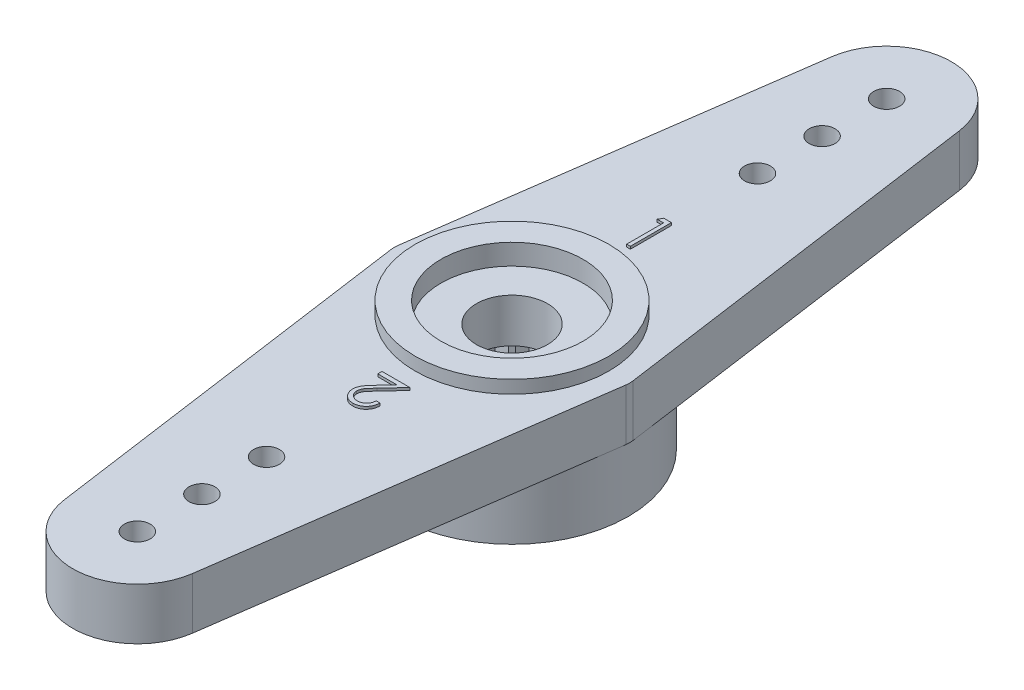
from build123d import *

# Parameters (mm, degrees)
SKETCH1_R           = 0.5
SKETCH1_R_2         = 1.375
BOSS_EXTRUDE1_DEPTH = 2
SKETCH2_R           = 3.75
SKETCH2_R_2         = 2.75
BOSS_EXTRUDE2_DEPTH = 0.5
CUT_EXTRUDE1_START  = -0.8
SKETCH3_R           = 2.75
SKETCH3_R_2         = 1.375
CUT_EXTRUDE1_DEPTH  = 0.8
SKETCH4_R           = 4.5
SKETCH4_R_2         = 2.5
BOSS_EXTRUDE3_DEPTH = 2.5
CUT_EXTRUDE3_START  = -2.5
CUT_EXTRUDE3_DEPTH  = 2.5
BOSS_EXTRUDE4_DEPTH = 0.1
FILLET1_R           = 1


with BuildPart() as part:
    # Sketch1 → Boss-Extrude1 (new body)
    with BuildSketch(Plane(origin=(0, 0, 0), x_dir=(1, 0, 0), z_dir=(0, 1, 0))):
        with BuildLine():
            Line((-4, 4), (-2.475677962, 14.847877319))
            ThreePointArc((-2.475677962, 14.847877319), (0, 17), (2.475677962, 14.847877319))
            Line((2.475677962, 14.847877319), (4, 4))
            Line((4, 4), (4.562072005, 0))
            Line((4.562072005, 0), (4, -4))
            Line((4, -4), (2.475677962, -14.847877319))
            ThreePointArc((2.475677962, -14.847877319), (0, -17), (-2.475677962, -14.847877319))
            Line((-2.475677962, -14.847877319), (-4, -4))
            Line((-4, -4), (-4.562072005, 0))
            Line((-4.562072005, 0), (-4, 4))
        make_face()
        with Locations(Location((0, -9.5, 0), (0, 0, 270))):
            Circle(SKETCH1_R, mode=Mode.SUBTRACT)
        with Locations(Location((0, -12, 0), (0, 0, 270))):
            Circle(SKETCH1_R, mode=Mode.SUBTRACT)
        with Locations(Location((0, 14.5, 0), (0, 0, 270))):
            Circle(SKETCH1_R, mode=Mode.SUBTRACT)
        with Locations(Location((0, 12, 0), (0, 0, 270))):
            Circle(SKETCH1_R, mode=Mode.SUBTRACT)
        with Locations(Location((0, 9.5, 0), (0, 0, 270))):
            Circle(SKETCH1_R, mode=Mode.SUBTRACT)
        with Locations(Location((0, -14.5, 0), (0, 0, 270))):
            Circle(SKETCH1_R, mode=Mode.SUBTRACT)
        with Locations(Location((0, 0, 0), (0, 0, 270))):
            Circle(SKETCH1_R_2, mode=Mode.SUBTRACT)
    extrude(amount=BOSS_EXTRUDE1_DEPTH)

    # Sketch2 → Boss-Extrude2 (add)
    with BuildSketch(Plane(origin=(0, 2, 0), x_dir=(1, 0, 0), z_dir=(0, 1, 0))):
        with Locations(Location((0, 0, 0), (0, 0, 270))):
            Circle(SKETCH2_R)
        with Locations(Location((0, 0, 0), (0, 0, 270))):
            Circle(SKETCH2_R_2, mode=Mode.SUBTRACT)
    extrude(amount=BOSS_EXTRUDE2_DEPTH)

    # Sketch3 → Cut-Extrude1 (cut)
    with BuildSketch(Plane(origin=(0, 2.5, 0), x_dir=(1, 0, 0), z_dir=(0, 1, 0)).offset(CUT_EXTRUDE1_START)):
        with Locations(Location((0, 0, 0), (0, 0, 270))):
            Circle(SKETCH3_R)
        with Locations(Location((0, 0, 0), (0, 0, 270))):
            Circle(SKETCH3_R_2, mode=Mode.SUBTRACT)
    extrude(amount=CUT_EXTRUDE1_DEPTH, mode=Mode.SUBTRACT)

    # Sketch4 → Boss-Extrude3 (add)
    with BuildSketch(Plane.XZ):
        with Locations(Location((0, 0, 0), (0, 0, 90))):
            Circle(SKETCH4_R)
        with Locations(Location((0, 0, 0), (0, 0, 270))):
            Circle(SKETCH4_R_2, mode=Mode.SUBTRACT)
    extrude(amount=BOSS_EXTRUDE3_DEPTH)

    # Sketch5 → Cut-Extrude3 (cut)
    with BuildSketch(Plane.XZ.offset(2.5).offset(CUT_EXTRUDE3_START)):
        with BuildLine():
            Line((0.299038106, 2.482050808), (0, 3))
            Line((0, 3), (-0.299038106, 2.482050808))
            ThreePointArc((-0.299038106, 2.482050808), (-0.391086163, 2.469220851), (-0.482593741, 2.452978451))
            Line((-0.482593741, 2.452978451), (-0.927050983, 2.853169549))
            Line((-0.927050983, 2.853169549), (-1.051398019, 2.268162738))
            ThreePointArc((-1.051398019, 2.268162738), (-1.134976249, 2.22751631), (-1.216985951, 2.183791473))
            Line((-1.216985951, 2.183791473), (-1.763355757, 2.427050983))
            Line((-1.763355757, 2.427050983), (-1.70083977, 1.832251096))
            ThreePointArc((-1.70083977, 1.832251096), (-1.767766953, 1.767766953), (-1.832251096, 1.70083977))
            Line((-1.832251096, 1.70083977), (-2.427050983, 1.763355757))
            Line((-2.427050983, 1.763355757), (-2.183791473, 1.216985951))
            ThreePointArc((-2.183791473, 1.216985951), (-2.22751631, 1.134976249), (-2.268162738, 1.051398019))
            Line((-2.268162738, 1.051398019), (-2.853169549, 0.927050983))
            Line((-2.853169549, 0.927050983), (-2.452978451, 0.482593741))
            ThreePointArc((-2.452978451, 0.482593741), (-2.469220851, 0.391086163), (-2.482050808, 0.299038106))
            Line((-2.482050808, 0.299038106), (-3, 0))
            Line((-3, 0), (-2.482050808, -0.299038106))
            ThreePointArc((-2.482050808, -0.299038106), (-2.469220851, -0.391086163), (-2.452978451, -0.482593741))
            Line((-2.452978451, -0.482593741), (-2.853169549, -0.927050983))
            Line((-2.853169549, -0.927050983), (-2.268162738, -1.051398019))
            ThreePointArc((-2.268162738, -1.051398019), (-2.22751631, -1.134976249), (-2.183791473, -1.216985951))
            Line((-2.183791473, -1.216985951), (-2.427050983, -1.763355757))
            Line((-2.427050983, -1.763355757), (-1.832251096, -1.70083977))
            ThreePointArc((-1.832251096, -1.70083977), (-1.767766953, -1.767766953), (-1.70083977, -1.832251096))
            Line((-1.70083977, -1.832251096), (-1.763355757, -2.427050983))
            Line((-1.763355757, -2.427050983), (-1.216985951, -2.183791473))
            ThreePointArc((-1.216985951, -2.183791473), (-1.134976249, -2.22751631), (-1.051398019, -2.268162738))
            Line((-1.051398019, -2.268162738), (-0.927050983, -2.853169549))
            Line((-0.927050983, -2.853169549), (-0.482593741, -2.452978451))
            ThreePointArc((-0.482593741, -2.452978451), (-0.391086163, -2.469220851), (-0.299038106, -2.482050808))
            Line((-0.299038106, -2.482050808), (0, -3))
            Line((0, -3), (0.299038106, -2.482050808))
            ThreePointArc((0.299038106, -2.482050808), (0.391086163, -2.469220851), (0.482593741, -2.452978451))
            Line((0.482593741, -2.452978451), (0.927050983, -2.853169549))
            Line((0.927050983, -2.853169549), (1.051398019, -2.268162738))
            ThreePointArc((1.051398019, -2.268162738), (1.134976249, -2.22751631), (1.216985951, -2.183791473))
            Line((1.216985951, -2.183791473), (1.763355757, -2.427050983))
            Line((1.763355757, -2.427050983), (1.70083977, -1.832251096))
            ThreePointArc((1.70083977, -1.832251096), (1.767766953, -1.767766953), (1.832251096, -1.70083977))
            Line((1.832251096, -1.70083977), (2.427050983, -1.763355757))
            Line((2.427050983, -1.763355757), (2.183791473, -1.216985951))
            ThreePointArc((2.183791473, -1.216985951), (2.22751631, -1.134976249), (2.268162738, -1.051398019))
            Line((2.268162738, -1.051398019), (2.853169549, -0.927050983))
            Line((2.853169549, -0.927050983), (2.452978451, -0.482593741))
            ThreePointArc((2.452978451, -0.482593741), (2.469220851, -0.391086163), (2.482050808, -0.299038106))
            Line((2.482050808, -0.299038106), (3, 0))
            Line((3, 0), (2.482050808, 0.299038106))
            ThreePointArc((2.482050808, 0.299038106), (2.469220851, 0.391086163), (2.452978451, 0.482593741))
            Line((2.452978451, 0.482593741), (2.853169549, 0.927050983))
            Line((2.853169549, 0.927050983), (2.268162738, 1.051398019))
            ThreePointArc((2.268162738, 1.051398019), (2.22751631, 1.134976249), (2.183791473, 1.216985951))
            Line((2.183791473, 1.216985951), (2.427050983, 1.763355757))
            Line((2.427050983, 1.763355757), (1.832251096, 1.70083977))
            ThreePointArc((1.832251096, 1.70083977), (1.767766953, 1.767766953), (1.70083977, 1.832251096))
            Line((1.70083977, 1.832251096), (1.763355757, 2.427050983))
            Line((1.763355757, 2.427050983), (1.216985951, 2.183791473))
            ThreePointArc((1.216985951, 2.183791473), (1.134976249, 2.22751631), (1.051398019, 2.268162738))
            Line((1.051398019, 2.268162738), (0.927050983, 2.853169549))
            Line((0.927050983, 2.853169549), (0.482593741, 2.452978451))
            ThreePointArc((0.482593741, 2.452978451), (0.391086163, 2.469220851), (0.299038106, 2.482050808))
        make_face()
    extrude(amount=CUT_EXTRUDE3_DEPTH, mode=Mode.SUBTRACT)

    # Sketch6 → Boss-Extrude4 (add)
    with BuildSketch(Plane(origin=(0, 2, 0), x_dir=(1, 0, 0), z_dir=(0, 1, 0))):
        Polygon((-0.212111879, 6.0875), (0.081410256, 6.0875), (0.081410256, 4.5), (-0.061057692, 4.5), (-0.061057692, 5.924679487), (-0.305288462, 5.924679487), align=None)
        with BuildLine():
            Line((0.34599359, -5.599038462), (0.488461538, -5.599038462))
            add(Edge.make_bspline(
                [(0.488461538, -5.599038462), (0.487533166, -5.617939279), (0.485709868, -5.655059981), (0.477167658, -5.709180577), (0.46495614, -5.760917347), (0.447649569, -5.809826741), (0.426277468, -5.856493025), (0.40011183, -5.900296523), (0.369710466, -5.941671981), (0.335129148, -5.979836023), (0.29760523, -6.014722729), (0.25736354, -6.045167992), (0.214817686, -6.070596953), (0.170336692, -6.091970581), (0.123406123, -6.107994605), (0.074474582, -6.119889389), (0.023320904, -6.127044708), (-0.011531495, -6.12781392), (-0.029256811, -6.128205128)],
                knots=[0, 0, 0, 0, 1.100776268, 2.161895295, 3.184016182, 4.190939212, 5.176500551, 6.166955529, 7.155448256, 8.160289653, 9.16017456, 10.133824356, 11.091467644, 12.04088621, 13.000931625, 13.972173743, 14.968683325, 16, 16, 16, 16], degree=3))
            add(Edge.make_bspline(
                [(-0.029256811, -6.128205128), (-0.046665234, -6.127800921), (-0.080872163, -6.127006668), (-0.130775818, -6.120083276), (-0.178395874, -6.109473794), (-0.223192652, -6.093752213), (-0.265625894, -6.074025069), (-0.305170205, -6.049491779), (-0.342781809, -6.021313179), (-0.376614792, -5.988075137), (-0.407694469, -5.952610063), (-0.434483272, -5.914733662), (-0.457553999, -5.875568297), (-0.476436669, -5.834808029), (-0.490750572, -5.792320125), (-0.501355803, -5.748511928), (-0.507418326, -5.702877864), (-0.508343658, -5.671985787), (-0.508814103, -5.656280048)],
                knots=[0, 0, 0, 0, 1.111674182, 2.184400057, 3.212814286, 4.223731311, 5.211378316, 6.196328225, 7.191884489, 8.207283132, 9.220262353, 10.201199469, 11.166417575, 12.120932471, 13.06540007, 14.026332106, 14.996573967, 16, 16, 16, 16], degree=3))
            add(Edge.make_bspline(
                [(-0.508814103, -5.656280048), (-0.508046075, -5.634169433), (-0.506523497, -5.590336212), (-0.493499653, -5.525922188), (-0.473157884, -5.463514275), (-0.448668396, -5.413285287), (-0.423956394, -5.372815356), (-0.401709565, -5.339477962), (-0.37551786, -5.303591998), (-0.345605049, -5.265012215), (-0.311455992, -5.224243848), (-0.273957876, -5.180455113), (-0.232142299, -5.134455695), (-0.202819526, -5.103017004), (-0.1876252, -5.086726262)],
                knots=[0, 0, 0, 0, 1.184416499, 2.348048165, 3.509039915, 4.696071444, 5.333504901, 6.05069495, 6.844171097, 7.714965912, 8.667477798, 9.695072654, 10.805644396, 12, 12, 12, 12], degree=3))
            Line((-0.1876252, -5.086726262), (0.209567808, -4.662820513))
            Line((0.209567808, -4.662820513), (-0.529166667, -4.662820513))
            Line((-0.529166667, -4.662820513), (-0.529166667, -4.5))
            Line((-0.529166667, -4.5), (0.549519231, -4.5))
            Line((0.549519231, -4.5), (-0.066145833, -5.15700621))
            add(Edge.make_bspline(
                [(-0.066145833, -5.15700621), (-0.081136472, -5.172652803), (-0.10993042, -5.202706705), (-0.15063927, -5.246597776), (-0.187261175, -5.287268318), (-0.219820431, -5.324898551), (-0.248343825, -5.359275147), (-0.272740096, -5.390667508), (-0.293117072, -5.418806234), (-0.31471242, -5.451862432), (-0.335305017, -5.492269991), (-0.353403803, -5.541401752), (-0.364360562, -5.592090897), (-0.36568164, -5.626334746), (-0.366346154, -5.643559696)],
                knots=[0, 0, 0, 0, 1.329530082, 2.553755191, 3.672934919, 4.687409497, 5.60679272, 6.413407421, 7.126401618, 7.737995624, 8.834647426, 9.90044882, 10.943907757, 12, 12, 12, 12], degree=3))
            add(Edge.make_bspline(
                [(-0.366346154, -5.643559696), (-0.366060761, -5.654392812), (-0.365498307, -5.675742806), (-0.360440353, -5.707024672), (-0.353009214, -5.737316681), (-0.341555532, -5.766244292), (-0.327794356, -5.794376458), (-0.310213439, -5.820857871), (-0.290123068, -5.846591221), (-0.266819222, -5.87069413), (-0.241235929, -5.892776139), (-0.214204803, -5.912335573), (-0.185607306, -5.928681993), (-0.155562618, -5.94208205), (-0.124154868, -5.952593749), (-0.091323211, -5.959877459), (-0.057158391, -5.964450586), (-0.033829626, -5.965069336), (-0.021942608, -5.965384615)],
                knots=[0, 0, 0, 0, 0.991504627, 1.954065223, 2.895985987, 3.842598665, 4.797835564, 5.759220273, 6.74786863, 7.784730864, 8.824135544, 9.839918996, 10.835834653, 11.835434876, 12.84861661, 13.863796685, 14.911511676, 16, 16, 16, 16], degree=3))
            add(Edge.make_bspline(
                [(-0.021942608, -5.965384615), (-0.009524809, -5.965073193), (0.014861697, -5.96446161), (0.050589548, -5.959826318), (0.084911307, -5.952806404), (0.117298087, -5.94163076), (0.148427683, -5.928551128), (0.177505966, -5.911615305), (0.20534978, -5.892263509), (0.231399316, -5.869700543), (0.255124815, -5.844230354), (0.276708114, -5.816506502), (0.294995857, -5.786037502), (0.311229702, -5.753554464), (0.323645389, -5.718164946), (0.334259911, -5.680734442), (0.341970146, -5.640728907), (0.344630167, -5.613166089), (0.34599359, -5.599038462)],
                knots=[0, 0, 0, 0, 1.031072318, 2.024855787, 2.988461151, 3.935103592, 4.865765533, 5.788564469, 6.724086513, 7.67908574, 8.64457978, 9.611397706, 10.591395687, 11.591555111, 12.622101007, 13.700900657, 14.821571223, 16, 16, 16, 16], degree=3))
        make_face()
    extrude(amount=BOSS_EXTRUDE4_DEPTH)

    # Fillet1
    fillet1_edges = [part.edges().sort_by_distance(p)[0] for p in [
        (-4.562072005, 1, 0),
        (4.562072005, 1, 0),
    ]]
    fillet(fillet1_edges, radius=FILLET1_R)


solid = part.part
